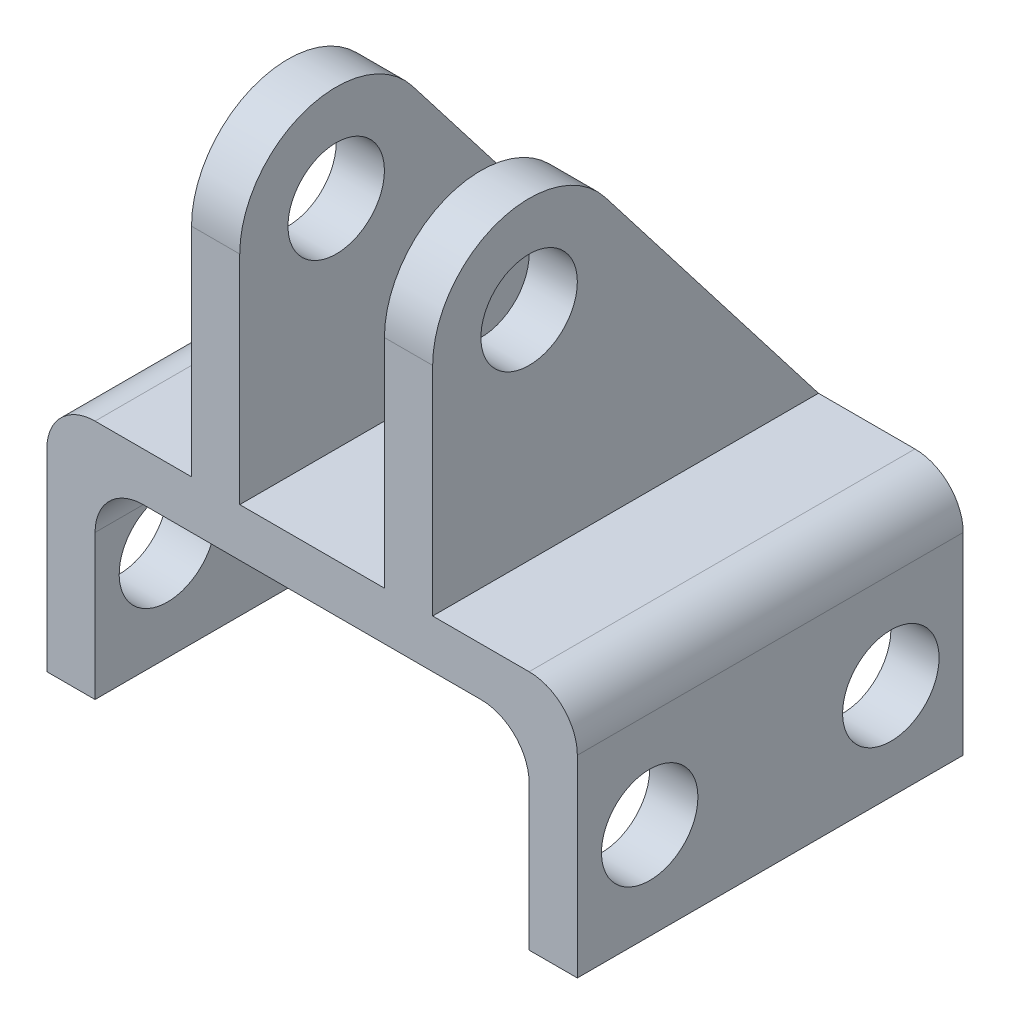
from build123d import *

# Parameters (mm, degrees)
SKETCH1_R                = 10
BOSS_EXTRUDE1_DEPTH      = 10
BOSS_EXTRUDE2_DEPTH      = 25
BOSS_EXTRUDE2_DEPTH_BACK = 30
SKETCH1_4_W              = 80.000017133
SKETCH1_4_H              = 10.000013225
BOSS_EXTRUDE3_START      = -30
SKETCH1_5_W              = 80.000017133
SKETCH1_5_H              = 40
SKETCH1_5_R              = 10
BOSS_EXTRUDE3_DEPTH      = 10
FILLET1_R                = 10


with BuildPart() as part:
    # Sketch1 → Boss-Extrude1 (new body)
    with BuildSketch(Plane(origin=(0, 0, 0), x_dir=(0, 0, -1), z_dir=(1, 0, 0))):
        with BuildLine():
            Line((0, 55), (0, 10.000013225))
            Line((0, 10.000013225), (80.000017133, 10.000013225))
            Line((80.000017133, 10.000013225), (35.832128843, 67.220625855))
            ThreePointArc((35.832128843, 67.220625855), (13.54409483, 73.929376335), (0, 55))
        make_face()
        with Locations((20, 55)):
            Circle(SKETCH1_R, mode=Mode.SUBTRACT)
    extrude(amount=BOSS_EXTRUDE1_DEPTH)

    # Sketch1<4> → Boss-Extrude2 (add, two sides: drawn at the far end of the back side and taken through both)
    with BuildSketch(Plane(origin=(0, 0, 0), x_dir=(0, 0, -1), z_dir=(1, 0, 0)).offset(-BOSS_EXTRUDE2_DEPTH_BACK)):
        with Locations((40.000008567, 5.000006613)):
            Rectangle(SKETCH1_4_W, SKETCH1_4_H)
    extrude(amount=BOSS_EXTRUDE2_DEPTH + BOSS_EXTRUDE2_DEPTH_BACK)

    # Sketch1<5> → Boss-Extrude3 (add)
    with BuildSketch(Plane(origin=(0, 0, 0), x_dir=(0, 0, -1), z_dir=(1, 0, 0)).offset(BOSS_EXTRUDE3_START)):
        with Locations((40.000008567, -20)):
            Rectangle(SKETCH1_5_W, SKETCH1_5_H)
        with Locations((15, -20)):
            Circle(SKETCH1_5_R, mode=Mode.SUBTRACT)
        with Locations((65, -20)):
            Circle(SKETCH1_5_R, mode=Mode.SUBTRACT)
    extrude(amount=BOSS_EXTRUDE3_DEPTH)

    # Mirror3: part across plane


with BuildPart() as part_1:
    add(part.part)
    add(part.part.mirror(Plane(origin=(25, 0, 0), x_dir=(0, 0, 1), z_dir=(1, 0, 0))))

    # Fillet1
    fillet1_edges = [part_1.edges().sort_by_distance(p)[0] for p in [
        (70, 0, -40.000008566),
        (-20, 0, -40.000008566),
        (80, 10.000013225, -40.000008566),
        (-30, 10.000013225, -40.000008566),
    ]]
    fillet(fillet1_edges, radius=FILLET1_R)


solid = part_1.part
